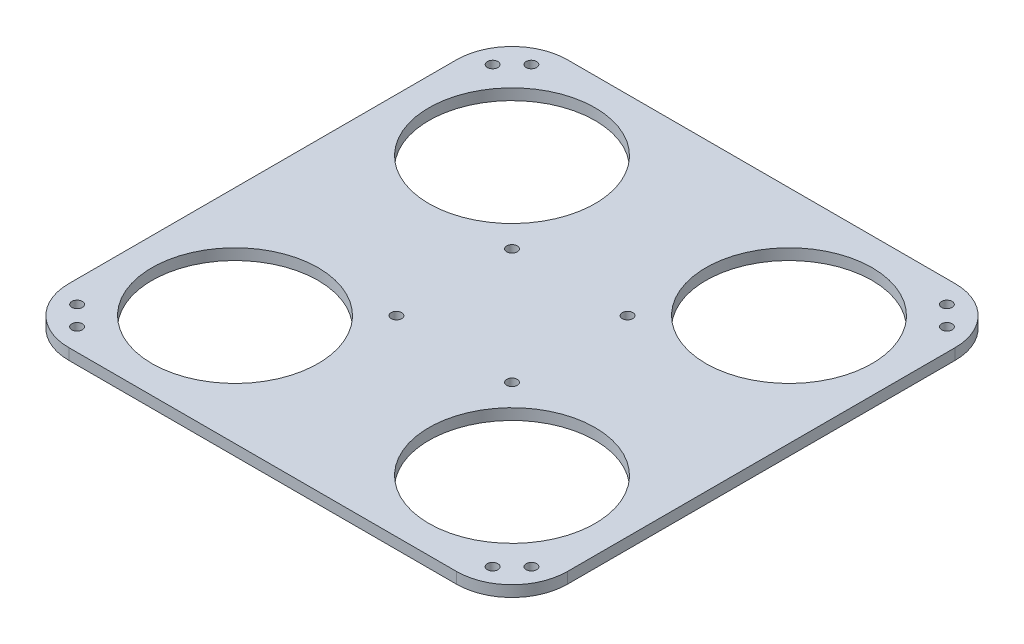
from build123d import *

# Parameters (mm, degrees)
SKETCH_1_W      = 180
SKETCH_1_H      = 180
SKETCH_1_R      = 1.9
SKETCH_1_R_2    = 30
EXTRUDE_1_DEPTH = 4
FILLET_1_R      = 20


with BuildPart() as part:
    # Эскиз1 → Бобышка-Вытянуть1 (new body)
    with BuildSketch(Plane(origin=(0, 0, 0), x_dir=(1, 0, 0), z_dir=(0, 1, 0))):
        Rectangle(SKETCH_1_W, SKETCH_1_H)
        with Locations(Location((-75, 82, 0), (0, 0, 270))):
            Circle(SKETCH_1_R, mode=Mode.SUBTRACT)
        with Locations(Location((-82, 75, 0), (0, 0, 270))):
            Circle(SKETCH_1_R, mode=Mode.SUBTRACT)
        with Locations(Location((82, 75, 0), (0, 0, 90))):
            Circle(SKETCH_1_R, mode=Mode.SUBTRACT)
        with Locations(Location((75, 82, 0), (0, 0, 90))):
            Circle(SKETCH_1_R, mode=Mode.SUBTRACT)
        with Locations(Location((75, -82, 0), (0, 0, 270))):
            Circle(SKETCH_1_R, mode=Mode.SUBTRACT)
        with Locations(Location((82, -75, 0), (0, 0, 270))):
            Circle(SKETCH_1_R, mode=Mode.SUBTRACT)
        with Locations(Location((-82, -75, 0), (0, 0, 90))):
            Circle(SKETCH_1_R, mode=Mode.SUBTRACT)
        with Locations(Location((-75, -82, 0), (0, 0, 90))):
            Circle(SKETCH_1_R, mode=Mode.SUBTRACT)
        with Locations(Location((20.859650045, 20.859650045, 0), (0, 0, 270))):
            Circle(SKETCH_1_R, mode=Mode.SUBTRACT)
        with Locations(Location((20.859650045, -20.859650045, 0), (0, 0, 270))):
            Circle(SKETCH_1_R, mode=Mode.SUBTRACT)
        with Locations(Location((-20.859650045, -20.859650045, 0), (0, 0, 270))):
            Circle(SKETCH_1_R, mode=Mode.SUBTRACT)
        with Locations(Location((-20.859650045, 20.859650045, 0), (0, 0, 270))):
            Circle(SKETCH_1_R, mode=Mode.SUBTRACT)
        with Locations(Location((-50, 50, 0), (0, 0, 270))):
            Circle(SKETCH_1_R_2, mode=Mode.SUBTRACT)
        with Locations(Location((50, 50, 0), (0, 0, 90))):
            Circle(SKETCH_1_R_2, mode=Mode.SUBTRACT)
        with Locations(Location((-50, -50, 0), (0, 0, 90))):
            Circle(SKETCH_1_R_2, mode=Mode.SUBTRACT)
        with Locations(Location((50, -50, 0), (0, 0, 270))):
            Circle(SKETCH_1_R_2, mode=Mode.SUBTRACT)
    extrude(amount=EXTRUDE_1_DEPTH)

    # Скругление1
    fillet_1_edges = [part.edges().sort_by_distance(p)[0] for p in [
        (90, 2, 90),
        (-90, 2, 90),
        (-90, 2, -90),
        (90, 2, -90),
    ]]
    fillet(fillet_1_edges, radius=FILLET_1_R)


solid = part.part
